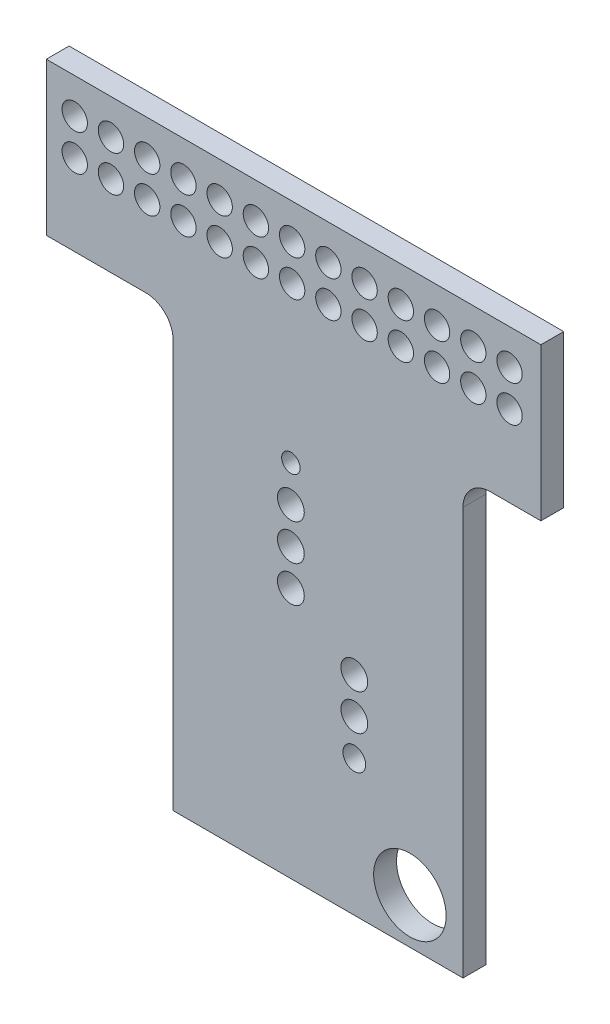
from build123d import *

# Parameters (mm, degrees)
MODEL_R             = 0.646540802
MODEL_R_2           = 0.797374503
MODEL_R_3           = 0.889
MODEL_R_4           = 0.9398
MODEL_R_5           = 2.54
BOSS_EXTRUDE1_DEPTH = 1.6002


with BuildPart() as part:
    # Model → Boss-Extrude1 (new body)
    with BuildSketch(Plane.XY):
        with BuildLine():
            Line((8.89, 0), (29.21, 0))
            Line((29.21, 0), (29.21, 28.575))
            ThreePointArc((29.21, 28.575), (29.767961582, 29.922038418), (31.115, 30.48))
            Line((31.115, 30.48), (34.671, 30.48))
            Line((34.671, 30.48), (34.671, 41.1734))
            Line((34.671, 41.1734), (0, 41.1734))
            Line((0, 41.1734), (0, 30.48))
            Line((0, 30.48), (6.985, 30.48))
            ThreePointArc((6.985, 30.48), (8.332038418, 29.922038418), (8.89, 28.575))
            Line((8.89, 28.575), (8.89, 0))
        make_face()
        with Locations((17.145, 25.24125)):
            Circle(MODEL_R, mode=Mode.SUBTRACT)
        with Locations((21.59, 9.525)):
            Circle(MODEL_R_2, mode=Mode.SUBTRACT)
        with Locations((1.9939, 38.7096)):
            Circle(MODEL_R_3, mode=Mode.SUBTRACT)
        with Locations((1.9939, 36.1696)):
            Circle(MODEL_R_3, mode=Mode.SUBTRACT)
        with Locations((4.5339, 36.1696)):
            Circle(MODEL_R_3, mode=Mode.SUBTRACT)
        with Locations((7.0739, 36.1696)):
            Circle(MODEL_R_3, mode=Mode.SUBTRACT)
        with Locations((9.6139, 36.1696)):
            Circle(MODEL_R_3, mode=Mode.SUBTRACT)
        with Locations((12.1539, 36.1696)):
            Circle(MODEL_R_3, mode=Mode.SUBTRACT)
        with Locations((4.5339, 38.7096)):
            Circle(MODEL_R_3, mode=Mode.SUBTRACT)
        with Locations((7.0739, 38.7096)):
            Circle(MODEL_R_3, mode=Mode.SUBTRACT)
        with Locations((9.6139, 38.7096)):
            Circle(MODEL_R_3, mode=Mode.SUBTRACT)
        with Locations((12.1539, 38.7096)):
            Circle(MODEL_R_3, mode=Mode.SUBTRACT)
        with Locations((14.6939, 38.7096)):
            Circle(MODEL_R_3, mode=Mode.SUBTRACT)
        with Locations((14.6939, 36.1696)):
            Circle(MODEL_R_3, mode=Mode.SUBTRACT)
        with Locations((17.2339, 36.1696)):
            Circle(MODEL_R_3, mode=Mode.SUBTRACT)
        with Locations((19.7739, 36.1696)):
            Circle(MODEL_R_3, mode=Mode.SUBTRACT)
        with Locations((22.3139, 36.1696)):
            Circle(MODEL_R_3, mode=Mode.SUBTRACT)
        with Locations((24.8539, 36.1696)):
            Circle(MODEL_R_3, mode=Mode.SUBTRACT)
        with Locations((17.2339, 38.7096)):
            Circle(MODEL_R_3, mode=Mode.SUBTRACT)
        with Locations((19.7739, 38.7096)):
            Circle(MODEL_R_3, mode=Mode.SUBTRACT)
        with Locations((22.3139, 38.7096)):
            Circle(MODEL_R_3, mode=Mode.SUBTRACT)
        with Locations((24.8539, 38.7096)):
            Circle(MODEL_R_3, mode=Mode.SUBTRACT)
        with Locations((27.3939, 38.7096)):
            Circle(MODEL_R_3, mode=Mode.SUBTRACT)
        with Locations((27.3939, 36.1696)):
            Circle(MODEL_R_3, mode=Mode.SUBTRACT)
        with Locations((29.9339, 36.1696)):
            Circle(MODEL_R_3, mode=Mode.SUBTRACT)
        with Locations((32.4739, 36.1696)):
            Circle(MODEL_R_3, mode=Mode.SUBTRACT)
        with Locations((29.9339, 38.7096)):
            Circle(MODEL_R_3, mode=Mode.SUBTRACT)
        with Locations((32.4739, 38.7096)):
            Circle(MODEL_R_3, mode=Mode.SUBTRACT)
        with Locations((21.59, 12.065)):
            Circle(MODEL_R_4, mode=Mode.SUBTRACT)
        with Locations((21.59, 14.605)):
            Circle(MODEL_R_4, mode=Mode.SUBTRACT)
        with Locations((17.145, 22.70125)):
            Circle(MODEL_R_4, mode=Mode.SUBTRACT)
        with Locations((17.145, 20.16125)):
            Circle(MODEL_R_4, mode=Mode.SUBTRACT)
        with Locations((17.145, 17.62125)):
            Circle(MODEL_R_4, mode=Mode.SUBTRACT)
        with Locations((25.4889, 3.175)):
            Circle(MODEL_R_5, mode=Mode.SUBTRACT)
    extrude(amount=BOSS_EXTRUDE1_DEPTH)


solid = part.part
